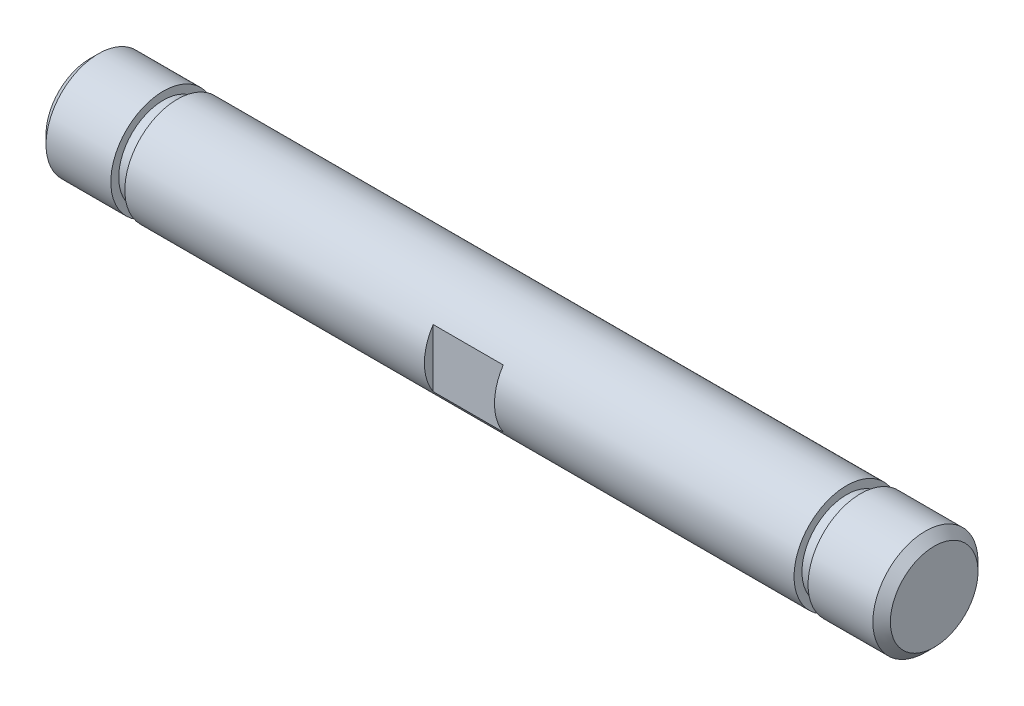
from build123d import *

# Parameters (mm, degrees)
CORTAR_EXTRUIR1_DEPTH = 2
CHAFL_N1_SIZE         = 0.5


with BuildPart() as part:
    # Croquis1 → Revolución1 (revolve)
    with BuildSketch(Plane(origin=(0, 0, 0), x_dir=(-1, 0, 0), z_dir=(0, 1, 0)), mode=Mode.PRIVATE) as revoluci_n1_sk:
        Polygon((-19.1, 3), (19.1, 3), (19.1, 2.55), (19.9, 2.55), (19.9, 3), (24.1, 3), (24.1, 0), (-24.1, 0), (-24.1, 3), (-19.9, 3), (-19.9, 2.55), (-19.1, 2.55), align=None)
    revolve(revoluci_n1_sk.sketch.rotate(Axis((24.1, 0, 0), (-1, 0, 0)), 180), axis=Axis((24.1, 0, 0), (-1, 0, 0)))

    # Croquis2 → Cortar-Extruir1 (cut, symmetric)
    with BuildSketch(Plane.YZ):
        with BuildLine():
            Line((1.658312395, 2.5), (-1.658312395, 2.5))
            ThreePointArc((-1.658312395, 2.5), (0, 3), (1.658312395, 2.5))
        make_face()
    extrude(amount=CORTAR_EXTRUIR1_DEPTH, both=True, mode=Mode.SUBTRACT)

    # Chaflán1
    chafl_n1_edges = [part.edges().sort_by_distance(p)[0] for p in [
        (-24.1, 0, 3),
        (24.1, 0, 3),
    ]]
    chamfer(chafl_n1_edges, length=CHAFL_N1_SIZE)


solid = part.part
